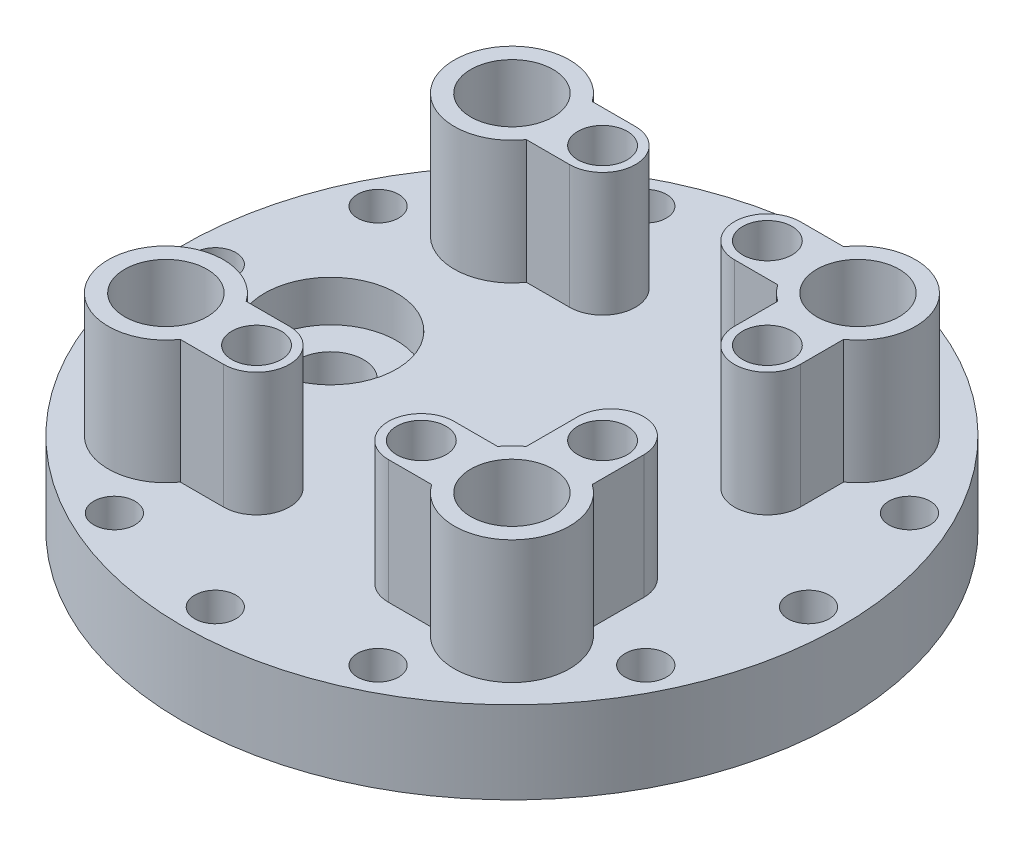
from build123d import *

# Parameters (mm, degrees)
SKETCH1_R           = 40
SKETCH1_R_2         = 5
SKETCH1_R_3         = 5.000393793
SKETCH1_R_4         = 2.5
SKETCH1_R_5         = 2.500004974
SKETCH1_R_6         = 2.503537869
BOSS_EXTRUDE4_DEPTH = 10
SKETCH2_R           = 4
CUT_EXTRUDE1_DEPTH  = 10
SKETCH3_R           = 8
CUT_EXTRUDE2_DEPTH  = 5
SKETCH4_R           = 3
SKETCH4_R_2         = 7
SKETCH4_R_3         = 5
SKETCH4_R_4         = 5.000393793
BOSS_EXTRUDE9_DEPTH = 15


with BuildPart() as part:
    # Sketch1 → Boss-Extrude4 (new body)
    with BuildSketch(Plane(origin=(0, 0, 0), x_dir=(1, 0, 0), z_dir=(0, 1, 0))):
        with Locations(Location((0, 0, 0), (0, 0, 270))):
            Circle(SKETCH1_R)
        with Locations(Location((-21, 21, 0), (0, 0, 270))):
            Circle(SKETCH1_R_2, mode=Mode.SUBTRACT)
        with Locations(Location((-21, -21, 0), (0, 0, 270))):
            Circle(SKETCH1_R_3, mode=Mode.SUBTRACT)
        with Locations(Location((21, -21, 0), (0, 0, 270))):
            Circle(SKETCH1_R_2, mode=Mode.SUBTRACT)
        with Locations(Location((21, 21, 0), (0, 0, 270))):
            Circle(SKETCH1_R_2, mode=Mode.SUBTRACT)
        with Locations(Location((36, 0, 0), (0, 0, 270))):
            Circle(SKETCH1_R_4, mode=Mode.SUBTRACT)
        with Locations(Location((0, 36, 0), (0, 0, 270))):
            Circle(SKETCH1_R_4, mode=Mode.SUBTRACT)
        with Locations(Location((0, -36, 0), (0, 0, 270))):
            Circle(SKETCH1_R_4, mode=Mode.SUBTRACT)
        with Locations(Location((16, 32.25, 0), (0, 0, 270))):
            Circle(SKETCH1_R_4, mode=Mode.SUBTRACT)
        with Locations(Location((-16, 32.25, 0), (0, 0, 270))):
            Circle(SKETCH1_R_4, mode=Mode.SUBTRACT)
        with Locations(Location((-32.25, 16, 0), (0, 0, 270))):
            Circle(SKETCH1_R_4, mode=Mode.SUBTRACT)
        with Locations(Location((-32.25, -16.004986802, 0), (0, 0, 270))):
            Circle(SKETCH1_R_5, mode=Mode.SUBTRACT)
        with Locations(Location((-16, -32.25, 0), (0, 0, 270))):
            Circle(SKETCH1_R_4, mode=Mode.SUBTRACT)
        with Locations(Location((16, -32.25, 0), (0, 0, 270))):
            Circle(SKETCH1_R_4, mode=Mode.SUBTRACT)
        with Locations(Location((32.25, 16, 0), (0, 0, 270))):
            Circle(SKETCH1_R_4, mode=Mode.SUBTRACT)
        with Locations(Location((32.25, -16.004986802, 0), (0, 0, 270))):
            Circle(SKETCH1_R_6, mode=Mode.SUBTRACT)
        with Locations(Location((-36, 0, 0), (0, 0, 270))):
            Circle(SKETCH1_R_4, mode=Mode.SUBTRACT)
    extrude(amount=BOSS_EXTRUDE4_DEPTH)

    # Sketch2 → Cut-Extrude1 (cut)
    with BuildSketch(Plane(origin=(0, 10, 0), x_dir=(1, 0, 0), z_dir=(0, 1, 0))):
        with Locations(Location((-22, 0, 0), (0, 0, 270))):
            Circle(SKETCH2_R)
    extrude(amount=-CUT_EXTRUDE1_DEPTH, mode=Mode.SUBTRACT)

    # Sketch3 → Cut-Extrude2 (cut)
    with BuildSketch(Plane(origin=(0, 10, 0), x_dir=(1, 0, 0), z_dir=(0, 1, 0))):
        with Locations(Location((-22, 0, 0), (0, 0, 270))):
            Circle(SKETCH3_R)
    extrude(amount=-CUT_EXTRUDE2_DEPTH, mode=Mode.SUBTRACT)

    # Sketch4 → Boss-Extrude9 (add)
    # profile 1 of 10: a face of its own
    with BuildSketch(Plane(origin=(0, 10, 0), x_dir=(1, 0, 0), z_dir=(0, 1, 0))):
        with BuildLine():
            Line((-15.255437353, 17), (-10, 17))
            ThreePointArc((-10, 17), (-6, 21), (-10, 25))
            Line((-10, 25), (-15.255437353, 25))
            ThreePointArc((-15.255437353, 25), (-14.321229959, 23.096194346), (-14, 21))
            ThreePointArc((-14, 21), (-14.321229959, 18.903805654), (-15.255437353, 17))
        make_face()
        with Locations(Location((-10, 21, 0), (0, 0, 270))):
            Circle(SKETCH4_R, mode=Mode.SUBTRACT)
    # profile 2 of 10: a face of its own
    with BuildSketch(Plane(origin=(0, 10, 0), x_dir=(1, 0, 0), z_dir=(0, 1, 0))):
        with Locations((-21, 21)):
            Circle(SKETCH4_R_2)
        with Locations(Location((-21, 21, 0), (0, 0, 270))):
            Circle(SKETCH4_R_3, mode=Mode.SUBTRACT)
    # profile 3 of 10: a face of its own
    with BuildSketch(Plane(origin=(0, 10, 0), x_dir=(1, 0, 0), z_dir=(0, 1, 0))):
        with Locations((-21, -21)):
            Circle(SKETCH4_R_2)
        with Locations(Location((-21, -21, 0), (0, 0, 270))):
            Circle(SKETCH4_R_4, mode=Mode.SUBTRACT)
    # profile 4 of 10: a face of its own
    with BuildSketch(Plane(origin=(0, 10, 0), x_dir=(1, 0, 0), z_dir=(0, 1, 0))):
        with BuildLine():
            ThreePointArc((-10, -25), (-6, -21), (-10, -17))
            Line((-10, -17), (-15.255437353, -17))
            ThreePointArc((-15.255437353, -17), (-14.321229959, -18.903805654), (-14, -21))
            ThreePointArc((-14, -21), (-14.321229959, -23.096194346), (-15.255437353, -25))
            Line((-15.255437353, -25), (-10, -25))
        make_face()
        with Locations(Location((-10, -21, 0), (0, 0, 270))):
            Circle(SKETCH4_R, mode=Mode.SUBTRACT)
    # profile 5 of 10: a face of its own
    with BuildSketch(Plane(origin=(0, 10, 0), x_dir=(1, 0, 0), z_dir=(0, 1, 0))):
        with Locations((21, -21)):
            Circle(SKETCH4_R_2)
        with Locations(Location((21, -21, 0), (0, 0, 270))):
            Circle(SKETCH4_R_3, mode=Mode.SUBTRACT)
    # profile 6 of 10: a face of its own
    with BuildSketch(Plane(origin=(0, 10, 0), x_dir=(1, 0, 0), z_dir=(0, 1, 0))):
        with BuildLine():
            ThreePointArc((10, -17), (6, -21), (10, -25))
            Line((10, -25), (15.255437353, -25))
            ThreePointArc((15.255437353, -25), (14, -21), (15.255437353, -17))
            Line((15.255437353, -17), (10, -17))
        make_face()
        with Locations(Location((10, -21, 0), (0, 0, 270))):
            Circle(SKETCH4_R, mode=Mode.SUBTRACT)
    # profile 7 of 10: a face of its own
    with BuildSketch(Plane(origin=(0, 10, 0), x_dir=(1, 0, 0), z_dir=(0, 1, 0))):
        with BuildLine():
            Line((17, -9), (17, -15.255437353))
            ThreePointArc((17, -15.255437353), (21, -14), (25, -15.255437353))
            Line((25, -15.255437353), (25, -9))
            ThreePointArc((25, -9), (21, -5), (17, -9))
        make_face()
        with Locations(Location((21, -10, 0), (0, 0, 270))):
            Circle(SKETCH4_R, mode=Mode.SUBTRACT)
    # profile 8 of 10: a face of its own
    with BuildSketch(Plane(origin=(0, 10, 0), x_dir=(1, 0, 0), z_dir=(0, 1, 0))):
        with Locations((21, 21)):
            Circle(SKETCH4_R_2)
        with Locations(Location((21, 21, 0), (0, 0, 270))):
            Circle(SKETCH4_R_3, mode=Mode.SUBTRACT)
    # profile 9 of 10: a face of its own
    with BuildSketch(Plane(origin=(0, 10, 0), x_dir=(1, 0, 0), z_dir=(0, 1, 0))):
        with BuildLine():
            Line((25, 10), (25, 15.255437353))
            ThreePointArc((25, 15.255437353), (21, 14), (17, 15.255437353))
            Line((17, 15.255437353), (17, 10))
            ThreePointArc((17, 10), (21, 6), (25, 10))
        make_face()
        with Locations(Location((21, 10, 0), (0, 0, 270))):
            Circle(SKETCH4_R, mode=Mode.SUBTRACT)
    # profile 10 of 10: a face of its own
    with BuildSketch(Plane(origin=(0, 10, 0), x_dir=(1, 0, 0), z_dir=(0, 1, 0))):
        with BuildLine():
            Line((15.255437353, 25), (10, 25))
            ThreePointArc((10, 25), (6, 21), (10, 17))
            Line((10, 17), (15.255437353, 17))
            ThreePointArc((15.255437353, 17), (14, 21), (15.255437353, 25))
        make_face()
        with Locations(Location((10, 21, 0), (0, 0, 270))):
            Circle(SKETCH4_R, mode=Mode.SUBTRACT)
    extrude(amount=BOSS_EXTRUDE9_DEPTH)


solid = part.part
